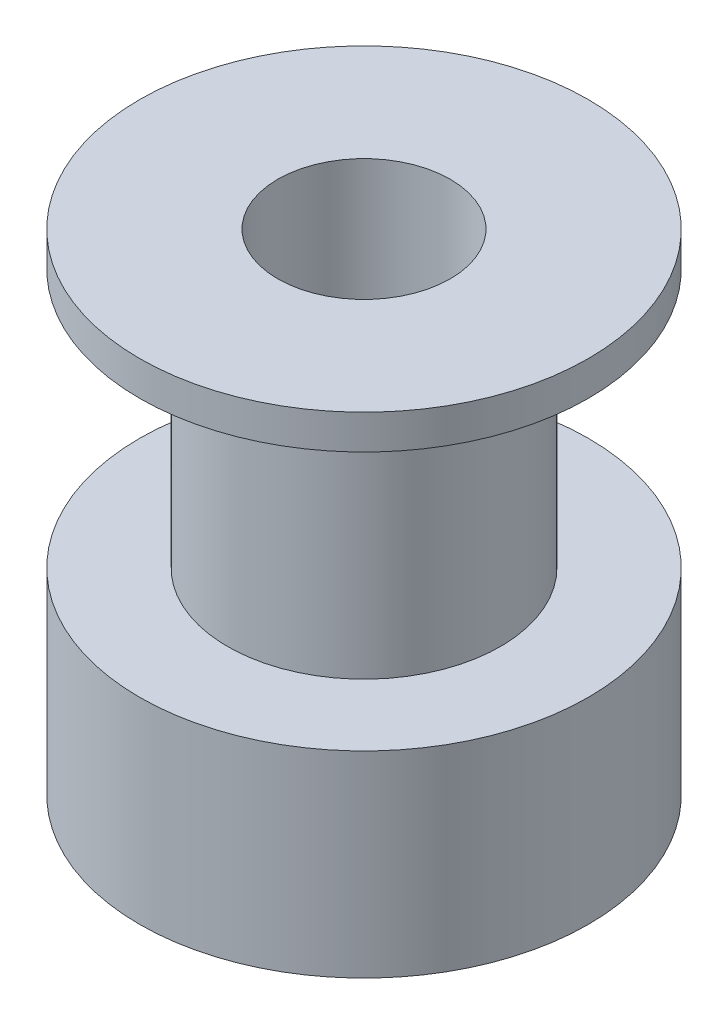
from build123d import *

# Parameters (mm, degrees)
SKETCH_2_R          = 2.5
CUT_EXTRUDE_1_DEPTH = 17.915673206


with BuildPart() as part:
    # 草图1 → 旋转5 (revolve)
    with BuildSketch(Plane.XY, mode=Mode.PRIVATE) as revolve_5_sk:
        Polygon((-6.5, 1.583191628), (0, 1.583191628), (0, 15.783191628), (-6.5, 15.783191628), (-6.5, 14.783191628), (-3.953126512, 14.783191628), (-3.953126512, 7.283191628), (-6.5, 7.283191628), align=None)
    revolve(revolve_5_sk.sketch.rotate(Axis((0, 0, 0), (0, 1, 0)), 270), axis=Axis((0, 0, 0), (0, 1, 0)))

    # 草图2 → 切除-拉伸1 (cut, through all)
    with BuildSketch(Plane(origin=(0, 15.783191628, 0), x_dir=(1, 0, 0), z_dir=(0, 1, 0))):
        with Locations(Location((0, 0, 0), (0, 0, 270))):
            Circle(SKETCH_2_R)
    extrude(amount=-CUT_EXTRUDE_1_DEPTH, mode=Mode.SUBTRACT)


solid = part.part
